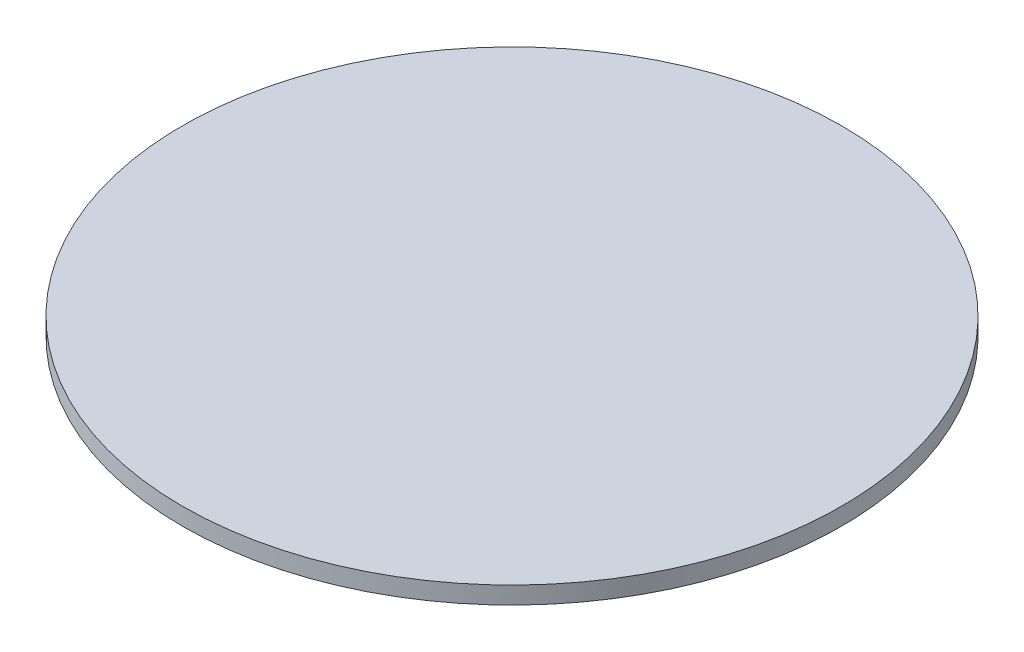
from build123d import *

# Parameters (mm, degrees)
SKETCH1_R           = 19
BOSS_EXTRUDE1_DEPTH = 1


with BuildPart() as part:
    # Sketch1 → Boss-Extrude1 (new body)
    with BuildSketch(Plane(origin=(0, 0, 0), x_dir=(1, 0, 0), z_dir=(0, 1, 0))):
        with Locations(Location((0, 0, 0), (0, 0, 270))):
            Circle(SKETCH1_R)
    extrude(amount=BOSS_EXTRUDE1_DEPTH)


solid = part.part
